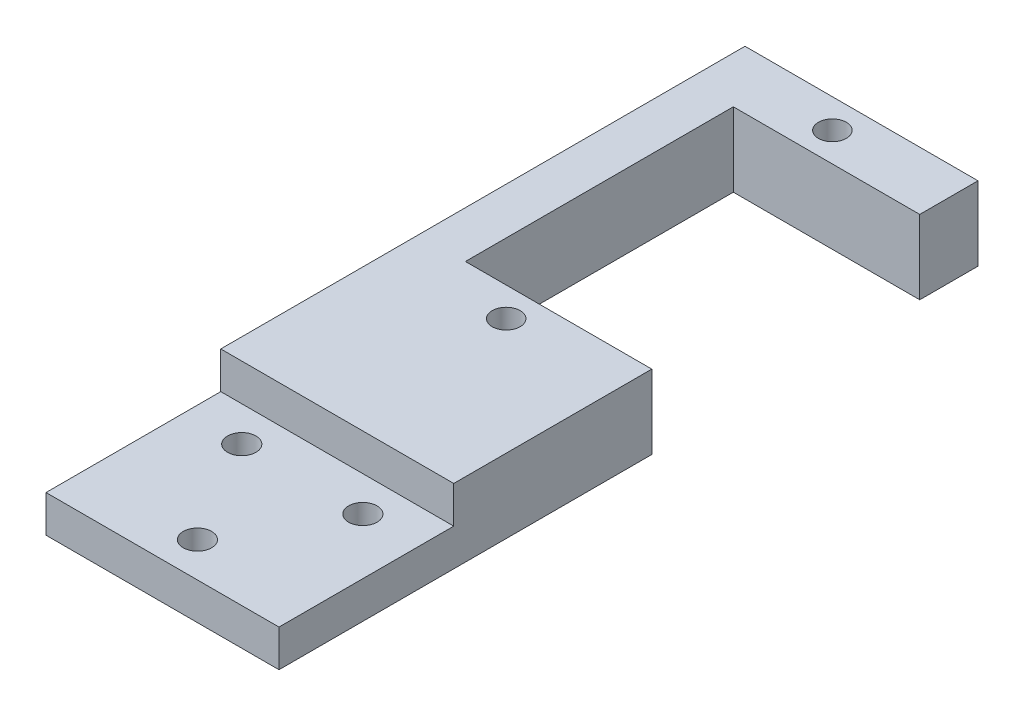
from build123d import *

# Parameters (mm, degrees)
SKETCH2_W             = 20
SKETCH2_H             = 60
BOSS_EXTRUDE1_DEPTH   = 6.35
SKETCH4_W             = 16
SKETCH4_H             = 23
CUT_EXTRUDE1_DEPTH    = 64.563531211
M2_CLEARANCE_HOLE1_D  = 2.4
SKETCH10_W            = 15
SKETCH10_H            = 3.175
CUT_EXTRUDE2_DEPTH    = 64.563531211
F_2_CLEARANCE_HOLE1_D = 2.4384


with BuildPart() as part:
    # Sketch2 → Boss-Extrude1 (new body)
    with BuildSketch(Plane(origin=(0, 0, 0), x_dir=(1, 0, 0), z_dir=(0, 1, 0))):
        with Locations((10, -30)):
            Rectangle(SKETCH2_W, SKETCH2_H)
    extrude(amount=BOSS_EXTRUDE1_DEPTH)

    # Sketch4 → Cut-Extrude1 (cut, through all)
    with BuildSketch(Plane(origin=(0, 6.35, 0), x_dir=(1, 0, 0), z_dir=(0, 1, 0))):
        with Locations((12, -16.5)):
            Rectangle(SKETCH4_W, SKETCH4_H)
    extrude(amount=-CUT_EXTRUDE1_DEPTH, mode=Mode.SUBTRACT)

    # M2 Clearance Hole1 (through all)
    with Locations(Plane(origin=(0, 6.35, 0), x_dir=(1, 0, 0), z_dir=(0, 1, 0))):
        with Locations((10, -30.5), (10, -2.5)):
            Hole(M2_CLEARANCE_HOLE1_D / 2)

    # Sketch10 → Cut-Extrude2 (cut, through all)
    with BuildSketch(Plane(origin=(20, 0, 0), x_dir=(0, 0, -1), z_dir=(1, 0, 0))):
        with Locations((-52.5, 4.7625)):
            Rectangle(SKETCH10_W, SKETCH10_H)
    extrude(amount=-CUT_EXTRUDE2_DEPTH, mode=Mode.SUBTRACT)

    # #2 Clearance Hole1 (through all)
    with Locations(Plane(origin=(0, 3.175, 0), x_dir=(1, 0, 0), z_dir=(0, 1, 0))):
        with Locations((4.803847577, -48), (15.196152423, -48), (10, -57)):
            Hole(F_2_CLEARANCE_HOLE1_D / 2)


solid = part.part
